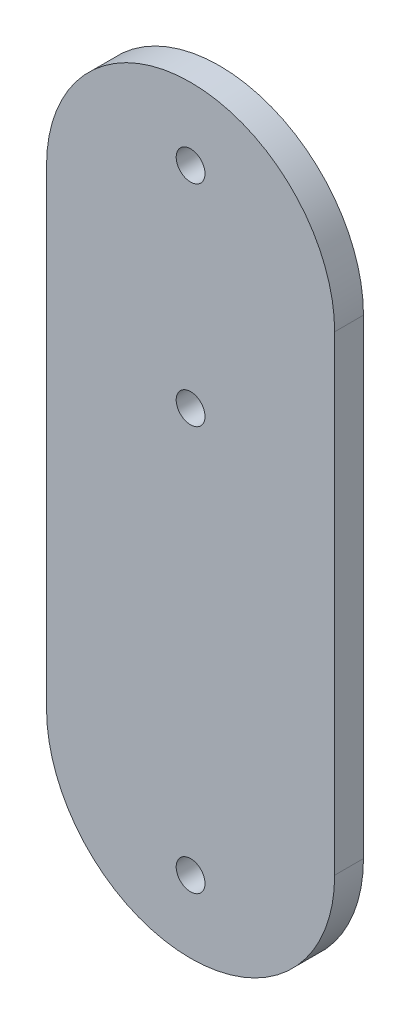
from build123d import *

# Parameters (mm, degrees)
SKETCH1_R           = 1.5
BOSS_EXTRUDE1_DEPTH = 3


with BuildPart() as part:
    # Sketch1 → Boss-Extrude1 (new body)
    with BuildSketch(Plane.XY):
        with BuildLine():
            Line((-5, 44.75), (-5, -4.25))
            ThreePointArc((-5, -4.25), (10, -19.25), (25, -4.25))
            Line((25, -4.25), (25, 44.75))
            ThreePointArc((25, 44.75), (10, 59.75), (-5, 44.75))
        make_face()
        with Locations((10, 52.25)):
            Circle(SKETCH1_R, mode=Mode.SUBTRACT)
        with Locations((10, -11.75)):
            Circle(SKETCH1_R, mode=Mode.SUBTRACT)
        with Locations((10, 30.36)):
            Circle(SKETCH1_R, mode=Mode.SUBTRACT)
    extrude(amount=BOSS_EXTRUDE1_DEPTH)


solid = part.part
